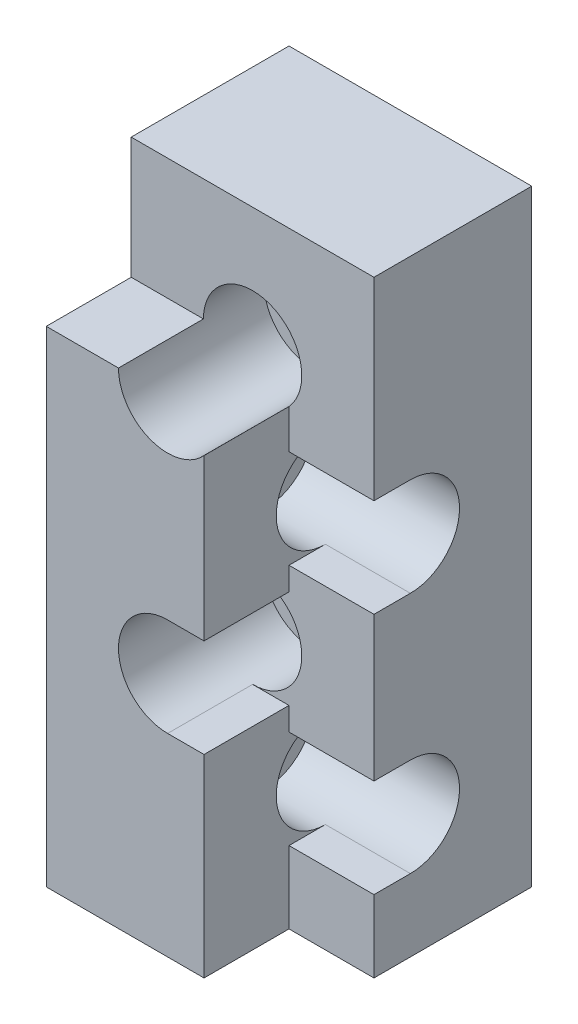
from build123d import *

# Parameters (mm, degrees)
SALIENTE_EXTRUIR1_DEPTH    = 40
CROQUIS2_W                 = 20
CROQUIS2_H                 = 13
SALIENTE_EXTRUIR2_DEPTH    = 10
CROQUIS3_R                 = 2.125
CORTAR_EXTRUIR1_DEPTH      = 56.398555938
CORTAR_EXTRUIR2_DEPTH      = 56.398555938
CORTAR_EXTRUIR2_DEPTH_BACK = 5
CROQUIS4_R                 = 4.05
CORTAR_EXTRUIR3_DEPTH      = 56.398555938
CORTAR_EXTRUIR3_DEPTH_BACK = 56.398555938
CROQUIS5_R                 = 2.125
CORTAR_EXTRUIR4_DEPTH      = 58.445626465
CORTAR_EXTRUIR4_DEPTH_BACK = 5
CORTAR_EXTRUIR4_START      = -7
CROQUIS6_R                 = 4.05
CORTAR_EXTRUIR5_START      = -7
CORTAR_EXTRUIR5_DEPTH      = 7
CORTAR_EXTRUIR6_DEPTH      = 7
CROQUIS9_R                 = 2.125
CORTAR_EXTRUIR7_DEPTH      = 58.445626465
CORTAR_EXTRUIR8_DEPTH      = 58.445626465
CORTAR_EXTRUIR8_DEPTH_BACK = 5
CORTAR_EXTRUIR8_START      = -7
CROQUIS10_R                = 4.05


with BuildPart() as part:
    # Croquis1 → Saliente-Extruir1 (new body)
    with BuildSketch(Plane(origin=(0, 0, 0), x_dir=(1, 0, 0), z_dir=(0, 1, 0))):
        Polygon((0, 0), (0, 20), (20, 20), (20, 7), (13, 7), (13, 0), align=None)
    extrude(amount=SALIENTE_EXTRUIR1_DEPTH)

    # Croquis2 → Saliente-Extruir2 (add)
    with BuildSketch(Plane(origin=(0, 40, 0), x_dir=(1, 0, 0), z_dir=(0, 1, 0))):
        with Locations((10, 13.5)):
            Rectangle(CROQUIS2_W, CROQUIS2_H)
    extrude(amount=SALIENTE_EXTRUIR2_DEPTH)

    # Croquis3 → Cortar-Extruir1 (cut, through all)
    with BuildSketch(Plane(origin=(13, 0, 0), x_dir=(0, 0, -1), z_dir=(1, 0, 0))):
        with Locations((10, 30)):
            Circle(CROQUIS3_R)
        with Locations((10, 10)):
            Circle(CROQUIS3_R)
    extrude(amount=-CORTAR_EXTRUIR1_DEPTH, mode=Mode.SUBTRACT)

    # Croquis4 → Cortar-Extruir2 (cut, two sides: drawn at the far end of the back side and taken through both)
    with BuildSketch(Plane(origin=(13, 0, 0), x_dir=(0, 0, -1), z_dir=(1, 0, 0)).offset(-CORTAR_EXTRUIR2_DEPTH_BACK)):
        with Locations(Location((10, 30, 0), (0, 0, 222.205446404))):
            Circle(CROQUIS4_R)
        with Locations(Location((10, 10, 0), (0, 0, 222.205446404))):
            Circle(CROQUIS4_R)
    extrude(amount=CORTAR_EXTRUIR2_DEPTH + CORTAR_EXTRUIR2_DEPTH_BACK, mode=Mode.SUBTRACT)

    # Croquis5 → Cortar-Extruir3 (cut, two sides: drawn at the far end of the back side and taken through both)
    with BuildSketch(Plane.XY.offset(-7).offset(-CORTAR_EXTRUIR3_DEPTH_BACK)):
        with Locations((10, 20)):
            Circle(CROQUIS5_R)
    extrude(amount=CORTAR_EXTRUIR3_DEPTH + CORTAR_EXTRUIR3_DEPTH_BACK, mode=Mode.SUBTRACT)

    # Croquis6 → Cortar-Extruir4 (cut, two sides: drawn at the far end of the back side and taken through both)
    with BuildSketch(Plane.XY.offset(CORTAR_EXTRUIR4_START - CORTAR_EXTRUIR4_DEPTH_BACK)):
        with Locations(Location((10, 20, 0), (0, 0, 180))):
            Circle(CROQUIS6_R)
    extrude(amount=CORTAR_EXTRUIR4_DEPTH + CORTAR_EXTRUIR4_DEPTH_BACK, mode=Mode.SUBTRACT)

    # Croquis7 → Cortar-Extruir5 (cut)
    with BuildSketch(Plane.XY.offset(CORTAR_EXTRUIR5_START)):
        with BuildLine():
            Line((10, 24.05), (18, 24.05))
            Line((18, 24.05), (18, 15.95))
            Line((18, 15.95), (10, 15.95))
            ThreePointArc((10, 15.95), (14.05, 20), (10, 24.05))
        make_face()
    extrude(amount=CORTAR_EXTRUIR5_DEPTH, mode=Mode.SUBTRACT)

    # Croquis8 → Cortar-Extruir6 (cut)
    with BuildSketch(Plane(origin=(20, 0, 0), x_dir=(0, 0, -1), z_dir=(1, 0, 0))):
        with BuildLine():
            Line((10, 34.05), (0, 34.05))
            Line((0, 34.05), (0, 25.95))
            Line((0, 25.95), (10, 25.95))
            ThreePointArc((10, 25.95), (5.95, 30), (10, 34.05))
        make_face()
        with BuildLine():
            Line((10, 14.05), (0, 14.05))
            Line((0, 14.05), (0, 5.95))
            Line((0, 5.95), (10, 5.95))
            ThreePointArc((10, 5.95), (5.95, 10), (10, 14.05))
        make_face()
    extrude(amount=-CORTAR_EXTRUIR6_DEPTH, mode=Mode.SUBTRACT)

    # Croquis9 → Cortar-Extruir7 (cut, through all)
    with BuildSketch(Plane.XY):
        with Locations((10, 40)):
            Circle(CROQUIS9_R)
    extrude(amount=-CORTAR_EXTRUIR7_DEPTH, mode=Mode.SUBTRACT)

    # Croquis10 → Cortar-Extruir8 (cut, two sides: drawn at the far end of the back side and taken through both)
    with BuildSketch(Plane.XY.offset(CORTAR_EXTRUIR8_START - CORTAR_EXTRUIR8_DEPTH_BACK)):
        with Locations(Location((10, 40, 0), (0, 0, 180))):
            Circle(CROQUIS10_R)
    extrude(amount=CORTAR_EXTRUIR8_DEPTH + CORTAR_EXTRUIR8_DEPTH_BACK, mode=Mode.SUBTRACT)


solid = part.part
